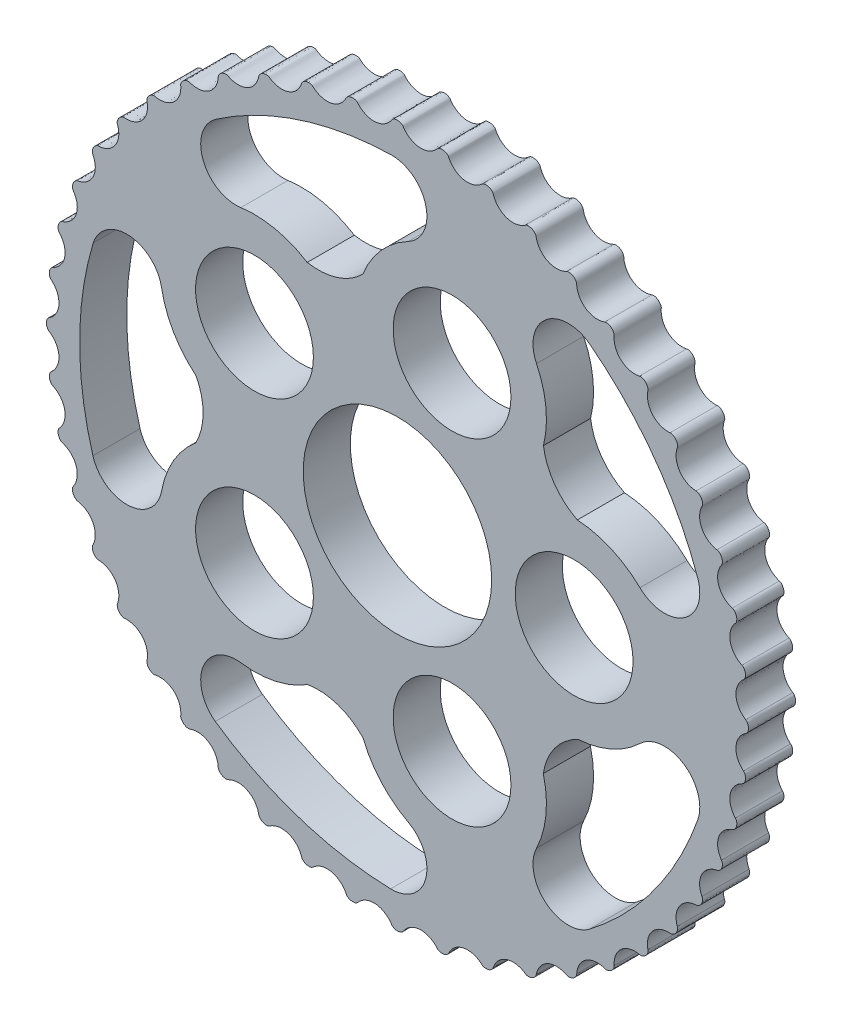
from build123d import *

# Parameters (mm, degrees)
SKETCH_1_R      = 7.999999987
SKETCH_1_R_2    = 5.000000092
EXTRUDE_1_DEPTH = 4


with BuildPart() as part:
    # 草图1 → 凸台-拉伸1 (new body)
    with BuildSketch(Plane.XY):
        with BuildLine():
            add(Edge.make_bspline(
                [(-23.756839752, 17.589365005), (-23.763816236, 17.620618264), (-23.787312136, 17.672369962), (-23.794612662, 17.752678085), (-23.783060954, 17.832767754), (-23.757608715, 17.926005606), (-23.71245772, 18.034169469), (-23.63979738, 18.153437438), (-23.536000753, 18.25759788), (-23.421446293, 18.33507133), (-23.327577909, 18.377245367), (-23.257706306, 18.399418334), (-23.188516209, 18.39633596), (-23.121984058, 18.395565423), (-23.037509241, 18.38632383), (-22.935847493, 18.386592603), (-22.782051162, 18.396327908), (-22.542591309, 18.440805009), (-22.228492548, 18.546094048), (-21.936202967, 18.718382637), (-21.733738096, 18.894659416), (-21.621993871, 19.022854745), (-21.537650729, 19.13374964), (-21.428664022, 19.302020109), (-21.325665583, 19.519010858), (-21.256733415, 19.761891962), (-21.228005331, 19.948605043), (-21.218444018, 20.101254916), (-21.22090932, 20.233384032), (-21.230567203, 20.375914819), (-21.244979436, 20.478014636), (-21.257722855, 20.539775848)],
                knots=[0, 0, 0, 0, 0.021406688, 0.037438778, 0.053080501, 0.075243885, 0.101831489, 0.131128233, 0.167942493, 0.199083228, 0.22289379, 0.2367033, 0.247360435, 0.268788888, 0.281242099, 0.304030641, 0.336575953, 0.384053579, 0.466276873, 0.556570973, 0.608579292, 0.644912928, 0.669952979, 0.701577431, 0.778695241, 0.829212237, 0.869702514, 0.904632057, 0.931223553, 0.957905827, 1, 1, 1, 1], degree=3))
            add(Edge.make_bspline(
                [(-21.257722855, 20.539775848), (-21.260561404, 20.571672056), (-21.2771012, 20.626047766), (-21.273856984, 20.706621649), (-21.251950297, 20.78451834), (-21.214545826, 20.873636344), (-21.155662887, 20.974981464), (-21.068056572, 21.083745001), (-20.951552274, 21.173466158), (-20.827865528, 21.235324454), (-20.729295385, 21.264885403), (-20.657127391, 21.277748603), (-20.588931555, 21.26566148), (-20.52306917, 21.256213346), (-20.440523317, 21.23602464), (-20.339696218, 21.223021593), (-20.185944923, 21.212599161), (-19.942728256, 21.225439973), (-19.617573676, 21.288830134), (-19.3052965, 21.421493324), (-19.081555007, 21.569835062), (-18.954033921, 21.682348114), (-18.855937658, 21.781285299), (-18.725919644, 21.93389057), (-18.595479395, 22.135580939), (-18.495434605, 22.367386708), (-18.442581347, 22.548752665), (-18.413177025, 22.698848596), (-18.398374926, 22.830169116), (-18.389346184, 22.972741139), (-18.390308417, 23.075848652), (-18.394881358, 23.138744838)],
                knots=[0, 0, 0, 0, 0.021406625, 0.037438715, 0.053080439, 0.075243825, 0.101831431, 0.131128177, 0.167942439, 0.199083176, 0.22289374, 0.236703251, 0.247360387, 0.268788841, 0.281242052, 0.304030595, 0.33657591, 0.384053539, 0.466276839, 0.556570945, 0.608579267, 0.644912905, 0.669952958, 0.701577412, 0.778695227, 0.829212226, 0.869702505, 0.904632051, 0.931223549, 0.957905825, 1, 1, 1, 1], degree=3))
            add(Edge.make_bspline(
                [(-18.394881358, 23.138744838), (-18.393532333, 23.170738674), (-18.402833174, 23.226808069), (-18.389099711, 23.306269176), (-18.35721288, 23.380640054), (-18.308496176, 23.464113378), (-18.236888796, 23.55690571), (-18.135835475, 23.653303841), (-18.008616926, 23.727050559), (-17.87791421, 23.772235289), (-17.776328869, 23.788677355), (-17.703099298, 23.792010695), (-17.637064573, 23.771125636), (-17.572998879, 23.753161565), (-17.493794373, 23.722371181), (-17.395527101, 23.6963188), (-17.244451571, 23.665916962), (-17.001639594, 23.646901773), (-16.670992679, 23.667308433), (-16.344071057, 23.758076321), (-16.102881221, 23.87594485), (-15.961765195, 23.970850495), (-15.851594265, 24.056137127), (-15.702769589, 24.190466082), (-15.547119398, 24.373405094), (-15.417673782, 24.590169267), (-15.341599682, 24.763084878), (-15.292855468, 24.908058683), (-15.261039235, 25.036323677), (-15.233478352, 25.176497488), (-15.220974122, 25.278848499), (-15.217298342, 25.341803488)],
                knots=[0, 0, 0, 0, 0.021406625, 0.037438715, 0.053080439, 0.075243825, 0.101831431, 0.131128177, 0.167942439, 0.199083176, 0.22289374, 0.236703251, 0.247360387, 0.268788841, 0.281242052, 0.304030595, 0.33657591, 0.384053539, 0.466276839, 0.556570945, 0.608579267, 0.644912905, 0.669952958, 0.701577412, 0.778695227, 0.829212226, 0.869702505, 0.904632051, 0.931223549, 0.957905825, 1, 1, 1, 1], degree=3))
            add(Edge.make_bspline(
                [(-15.217298342, 25.341803488), (-15.211784824, 25.37334753), (-15.213687571, 25.430151246), (-15.189699844, 25.507139976), (-15.148378461, 25.576712534), (-15.08918308, 25.653112927), (-15.006076481, 25.735764769), (-14.893305204, 25.818148095), (-14.75754915, 25.874658547), (-14.622066823, 25.902396588), (-14.519204439, 25.905438441), (-14.446166268, 25.899184887), (-14.383422527, 25.869859241), (-14.322249706, 25.843686605), (-14.247741756, 25.802821374), (-14.153715693, 25.764165422), (-14.007900871, 25.714304362), (-13.769648164, 25.663758528), (-13.439166376, 25.640832524), (-13.103194027, 25.688152045), (-12.848682673, 25.773530601), (-12.696386242, 25.849204978), (-12.5760257, 25.919381779), (-12.410940792, 26.033136013), (-12.232743878, 26.194193529), (-12.076112285, 26.392207211), (-11.978118993, 26.553713843), (-11.910868914, 26.691084981), (-11.862582932, 26.814099798), (-11.816961482, 26.949476986), (-11.79120474, 27.04932024), (-11.779343132, 27.111256855)],
                knots=[0, 0, 0, 0, 0.021406625, 0.037438715, 0.053080439, 0.075243825, 0.101831431, 0.131128177, 0.167942439, 0.199083176, 0.22289374, 0.236703251, 0.247360387, 0.268788841, 0.281242052, 0.304030595, 0.33657591, 0.384053539, 0.466276839, 0.556570945, 0.608579267, 0.644912905, 0.669952958, 0.701577412, 0.778695227, 0.829212226, 0.869702505, 0.904632051, 0.931223549, 0.957905825, 1, 1, 1, 1], degree=3))
            add(Edge.make_bspline(
                [(-11.779343132, 27.111256855), (-11.769759459, 27.141811374), (-11.764231555, 27.198377485), (-11.7304, 27.271576539), (-11.680351087, 27.335160372), (-11.611689878, 27.4031806), (-11.518506037, 27.474277757), (-11.395946352, 27.541236677), (-11.253975616, 27.579543953), (-11.116031818, 27.589360699), (-11.013652394, 27.578950294), (-10.942055328, 27.563216845), (-10.883676133, 27.525952383), (-10.826442868, 27.492019002), (-10.757906328, 27.441778139), (-10.669730285, 27.39118003), (-10.531671103, 27.322712885), (-10.302054236, 27.241501259), (-9.97739221, 27.175634861), (-9.638117714, 27.178696365), (-9.374639602, 27.230124098), (-9.2137686, 27.285272397), (-9.085277849, 27.339138623), (-8.906757358, 27.430371769), (-8.709062719, 27.566792051), (-8.527925158, 27.742667173), (-8.409689367, 27.890001403), (-8.32508409, 28.017419414), (-8.261154546, 28.133079237), (-8.198253125, 28.26134346), (-8.159684576, 28.356970612), (-8.139840095, 28.4168291)],
                knots=[0, 0, 0, 0, 0.021406625, 0.037438715, 0.053080439, 0.075243825, 0.101831431, 0.131128177, 0.167942439, 0.199083176, 0.22289374, 0.236703251, 0.247360387, 0.268788841, 0.281242052, 0.304030595, 0.33657591, 0.384053539, 0.466276839, 0.556570945, 0.608579267, 0.644912905, 0.669952958, 0.701577412, 0.778695227, 0.829212226, 0.869702505, 0.904632051, 0.931223549, 0.957905825, 1, 1, 1, 1], degree=3))
            add(Edge.make_bspline(
                [(-8.139840095, 28.4168291), (-8.126350246, 28.445871301), (-8.113486275, 28.501231945), (-8.070389761, 28.569388866), (-8.012469667, 28.625896036), (-7.935517443, 28.684372257), (-7.833850762, 28.742698235), (-7.703599699, 28.793087063), (-7.557843439, 28.812535716), (-7.419798427, 28.804263199), (-7.319653704, 28.78057866), (-7.250722788, 28.755634521), (-7.197707023, 28.711068847), (-7.145392592, 28.669955331), (-7.08400014, 28.611198472), (-7.003182833, 28.549523954), (-6.875241523, 28.463622216), (-6.658189305, 28.353134351), (-6.344902097, 28.245454551), (-6.008130535, 28.204205655), (-5.740193849, 28.220802623), (-5.573500823, 28.254481241), (-5.439078374, 28.291115225), (-5.250176836, 28.358266259), (-5.036367082, 28.467715118), (-4.833822868, 28.618442408), (-4.697367625, 28.749083305), (-4.59685477, 28.864368033), (-4.518375516, 28.97069389), (-4.439270385, 29.089650513), (-4.388549946, 29.179425355), (-4.361062137, 29.236181521)],
                knots=[0, 0, 0, 0, 0.021406625, 0.037438715, 0.053080439, 0.075243825, 0.101831431, 0.131128177, 0.167942439, 0.199083176, 0.22289374, 0.236703251, 0.247360387, 0.268788841, 0.281242052, 0.304030595, 0.33657591, 0.384053539, 0.466276839, 0.556570945, 0.608579267, 0.644912905, 0.669952958, 0.701577412, 0.778695227, 0.829212226, 0.869702505, 0.904632051, 0.931223549, 0.957905825, 1, 1, 1, 1], degree=3))
            add(Edge.make_bspline(
                [(-4.361062137, 29.236181521), (-4.343896928, 29.263214483), (-4.323916996, 29.316422424), (-4.272292915, 29.378371029), (-4.20749267, 29.426834684), (-4.123566104, 29.474766351), (-4.015156128, 29.519323177), (-3.879442319, 29.552279747), (-3.732394465, 29.552537004), (-3.596610228, 29.52631677), (-3.50041371, 29.489763346), (-3.43532837, 29.456035318), (-3.38858315, 29.404930964), (-3.342082668, 29.357340776), (-3.288884745, 29.291073267), (-3.216808982, 29.219377607), (-3.101174654, 29.117511078), (-2.900400908, 28.979637453), (-2.60384895, 28.831986682), (-2.275342576, 28.747133167), (-2.007531787, 28.72861539), (-1.837868901, 28.740248076), (-1.699814761, 28.759023001), (-1.503764332, 28.800942951), (-1.277497807, 28.881547687), (-1.057012529, 29.004548159), (-0.90467262, 29.116260422), (-0.78997199, 29.217439313), (-0.698285828, 29.312611939), (-0.604330497, 29.420225579), (-0.542326011, 29.50261204), (-0.507665197, 29.55529477)],
                knots=[0, 0, 0, 0, 0.021406625, 0.037438715, 0.053080439, 0.075243825, 0.101831431, 0.131128177, 0.167942439, 0.199083176, 0.22289374, 0.236703251, 0.247360387, 0.268788841, 0.281242052, 0.304030595, 0.33657591, 0.384053539, 0.466276839, 0.556570945, 0.608579267, 0.644912905, 0.669952958, 0.701577412, 0.778695227, 0.829212226, 0.869702505, 0.904632051, 0.931223549, 0.957905825, 1, 1, 1, 1], degree=3))
            add(Edge.make_bspline(
                [(-0.507665197, 29.55529477), (-0.487118329, 29.579855952), (-0.460364298, 29.630000787), (-0.401095952, 29.684681119), (-0.330524306, 29.72427203), (-0.241059406, 29.760839021), (-0.127761059, 29.790864316), (0.011093395, 29.805824731), (0.156916812, 29.78688619), (0.288116969, 29.743166875), (0.378719334, 29.694370005), (0.438845468, 29.652435184), (0.478520319, 29.595666559), (0.518411218, 29.54241398), (0.56250438, 29.469769677), (0.624605363, 29.389279609), (0.725954173, 29.273191254), (0.907014153, 29.110290924), (1.181756774, 28.925195528), (1.496377125, 28.79818926), (1.759479701, 28.744873582), (1.929209467, 28.734261299), (2.068533154, 28.734855921), (2.268377996, 28.750827524), (2.503229808, 28.801208967), (2.737883588, 28.894378049), (2.903501584, 28.98525025), (3.03042743, 29.070592105), (3.133751725, 29.15298307), (3.240949654, 29.24741243), (3.313177274, 29.321000853), (3.354418036, 29.368708731)],
                knots=[0, 0, 0, 0, 0.021406625, 0.037438715, 0.053080439, 0.075243825, 0.101831431, 0.131128177, 0.167942439, 0.199083176, 0.22289374, 0.236703251, 0.247360387, 0.268788841, 0.281242052, 0.304030595, 0.33657591, 0.384053539, 0.466276839, 0.556570945, 0.608579267, 0.644912905, 0.669952958, 0.701577412, 0.778695227, 0.829212226, 0.869702505, 0.904632051, 0.931223549, 0.957905825, 1, 1, 1, 1], degree=3))
            add(Edge.make_bspline(
                [(3.354418036, 29.368708731), (3.377994999, 29.390377884), (3.41106536, 29.436601622), (3.476963873, 29.483078084), (3.552099419, 29.513118842), (3.645571885, 29.537695484), (3.761820036, 29.552675506), (3.901439297, 29.54938379), (4.0435432, 29.511573496), (4.167914406, 29.451103148), (4.251372385, 29.390897761), (4.305510539, 29.341473662), (4.337436174, 29.280012093), (4.370034944, 29.222008291), (4.404268898, 29.144230157), (4.455332537, 29.056322888), (4.540661723, 28.92799901), (4.69890995, 28.742859246), (4.947142313, 28.523486258), (5.242493398, 28.356500351), (5.496386002, 28.269299018), (5.663278526, 28.236623345), (5.801487894, 28.219027489), (6.001707747, 28.208777467), (6.241126468, 28.228073577), (6.485933758, 28.28981712), (6.661996071, 28.35829441), (6.798975396, 28.426339006), (6.912169917, 28.494538579), (7.030776257, 28.574167944), (7.111991176, 28.637699212), (7.159106245, 28.679615943)],
                knots=[0, 0, 0, 0, 0.021406625, 0.037438715, 0.053080439, 0.075243825, 0.101831431, 0.131128177, 0.167942439, 0.199083176, 0.22289374, 0.236703251, 0.247360387, 0.268788841, 0.281242052, 0.304030595, 0.33657591, 0.384053539, 0.466276839, 0.556570945, 0.608579267, 0.644912905, 0.669952958, 0.701577412, 0.778695227, 0.829212226, 0.869702505, 0.904632051, 0.931223549, 0.957905825, 1, 1, 1, 1], degree=3))
            add(Edge.make_bspline(
                [(7.159106245, 28.679615943), (7.185309897, 28.698022302), (7.224130745, 28.739534041), (7.295531882, 28.777011409), (7.373945739, 28.796988007), (7.46982643, 28.809153787), (7.587035348, 28.808832226), (7.725030492, 28.7873447), (7.860983442, 28.731309597), (7.976397671, 28.655122881), (8.051283275, 28.584539107), (8.098507131, 28.528471391), (8.122137293, 28.463368503), (8.146886161, 28.401605938), (8.170675155, 28.320024779), (8.209827736, 28.226204427), (8.277677292, 28.087840684), (8.410406095, 27.883629277), (8.627880875, 27.633732231), (8.898909156, 27.429623858), (9.139247616, 27.310028911), (9.30044732, 27.255848936), (9.435177567, 27.220363673), (9.632346615, 27.184067406), (9.872235724, 27.171948021), (10.123007803, 27.201209576), (10.306501958, 27.24612029), (10.451191008, 27.295703366), (10.572318964, 27.348544632), (10.700304329, 27.412011523), (10.789116938, 27.464398598), (10.841300162, 27.499806975)],
                knots=[0, 0, 0, 0, 0.021406625, 0.037438715, 0.053080439, 0.075243825, 0.101831431, 0.131128177, 0.167942439, 0.199083176, 0.22289374, 0.236703251, 0.247360387, 0.268788841, 0.281242052, 0.304030595, 0.33657591, 0.384053539, 0.466276839, 0.556570945, 0.608579267, 0.644912905, 0.669952958, 0.701577412, 0.778695227, 0.829212226, 0.869702505, 0.904632051, 0.931223549, 0.957905825, 1, 1, 1, 1], degree=3))
            add(Edge.make_bspline(
                [(10.841300162, 27.499806975), (10.86968215, 27.514635603), (10.913589249, 27.550725065), (10.989271318, 27.578562091), (11.069621803, 27.588132724), (11.166270175, 27.587679483), (11.282434382, 27.572061838), (11.416444273, 27.53274616), (11.543920078, 27.459445024), (11.64840256, 27.368845517), (11.713434477, 27.289091064), (11.75293602, 27.227339065), (11.767866391, 27.159708786), (11.784341896, 27.095244233), (11.797278894, 27.011255926), (11.823850506, 26.913127782), (11.873059508, 26.767091616), (11.977997859, 26.547302681), (12.160994003, 26.271157383), (12.40306211, 26.033418897), (12.625734169, 25.883476636), (12.778482881, 25.808719396), (12.907428736, 25.755951888), (13.098173362, 25.694230415), (13.334428289, 25.650902901), (13.586874377, 25.647181795), (13.77466074, 25.667757499), (13.924583845, 25.698030673), (14.051572704, 25.734609504), (14.186747227, 25.780827985), (14.281637918, 25.82117451), (14.337996428, 25.849468685)],
                knots=[0, 0, 0, 0, 0.021406625, 0.037438715, 0.053080439, 0.075243825, 0.101831431, 0.131128177, 0.167942439, 0.199083176, 0.22289374, 0.236703251, 0.247360387, 0.268788841, 0.281242052, 0.304030595, 0.33657591, 0.384053539, 0.466276839, 0.556570945, 0.608579267, 0.644912905, 0.669952958, 0.701577412, 0.778695227, 0.829212226, 0.869702505, 0.904632051, 0.931223549, 0.957905825, 1, 1, 1, 1], degree=3))
            add(Edge.make_bspline(
                [(14.337996428, 25.849468685), (14.368071128, 25.860465859), (14.416313216, 25.890515545), (14.494981275, 25.908235928), (14.575893569, 25.907236841), (14.671655941, 25.894172333), (14.784787835, 25.863525828), (14.912519527, 25.807054701), (15.029337041, 25.717741734), (15.121100052, 25.614279618), (15.175165567, 25.526719107), (15.206268916, 25.460339419), (15.212244032, 25.391338922), (15.220164275, 25.325275387), (15.222027921, 25.240316994), (15.235563916, 25.139560059), (15.265290383, 24.988350189), (15.34064276, 24.756744375), (15.486029152, 24.459075749), (15.694995234, 24.19177492), (15.896190909, 24.014050901), (16.037875058, 23.919995511), (16.158830221, 23.850848625), (16.339886732, 23.764758018), (16.568465089, 23.690963721), (16.818265765, 23.654323623), (17.007131257, 23.650212259), (17.159723191, 23.660657551), (17.290400138, 23.680348073), (17.430450947, 23.708527332), (17.529796113, 23.736142966), (17.589365599, 23.756838819)],
                knots=[0, 0, 0, 0, 0.021406625, 0.037438715, 0.053080439, 0.075243825, 0.101831431, 0.131128177, 0.167942439, 0.199083176, 0.22289374, 0.236703251, 0.247360387, 0.268788841, 0.281242052, 0.304030595, 0.33657591, 0.384053539, 0.466276839, 0.556570945, 0.608579267, 0.644912905, 0.669952958, 0.701577412, 0.778695227, 0.829212226, 0.869702505, 0.904632051, 0.931223549, 0.957905825, 1, 1, 1, 1], degree=3))
            add(Edge.make_bspline(
                [(17.589365599, 23.756838819), (17.620618425, 23.763816375), (17.672370067, 23.787312125), (17.752678084, 23.794612666), (17.832767755, 23.783060952), (17.926005605, 23.757608716), (18.034169469, 23.71245772), (18.153437438, 23.63979738), (18.25759788, 23.536000753), (18.33507133, 23.421446293), (18.377245367, 23.327577909), (18.399418334, 23.257706306), (18.39633596, 23.188516209), (18.395565423, 23.121984058), (18.38632383, 23.037509241), (18.386592603, 22.935847493), (18.396327908, 22.782051162), (18.440805009, 22.542591309), (18.546094048, 22.228492548), (18.718382637, 21.936202967), (18.894659416, 21.733738096), (19.022854745, 21.621993871), (19.13374964, 21.537650729), (19.302020109, 21.428664022), (19.519010858, 21.325665583), (19.761891962, 21.256733415), (19.948605043, 21.228005331), (20.101254916, 21.218444018), (20.233384032, 21.22090932), (20.375914819, 21.230567203), (20.478014636, 21.244979436), (20.539775848, 21.257722855)],
                knots=[0, 0, 0, 0, 0.021406625, 0.037438715, 0.053080439, 0.075243825, 0.101831431, 0.131128177, 0.167942439, 0.199083176, 0.22289374, 0.236703251, 0.247360387, 0.268788841, 0.281242052, 0.304030595, 0.33657591, 0.384053539, 0.466276839, 0.556570945, 0.608579267, 0.644912905, 0.669952958, 0.701577412, 0.778695227, 0.829212226, 0.869702505, 0.904632051, 0.931223549, 0.957905825, 1, 1, 1, 1], degree=3))
            add(Edge.make_bspline(
                [(20.539775848, 21.257722855), (20.571672056, 21.260561404), (20.626047766, 21.2771012), (20.706621649, 21.273856984), (20.78451834, 21.251950297), (20.873636344, 21.214545826), (20.974981464, 21.155662887), (21.083745001, 21.068056572), (21.173466158, 20.951552274), (21.235324454, 20.827865528), (21.264885403, 20.729295385), (21.277748603, 20.657127391), (21.26566148, 20.588931555), (21.256213346, 20.52306917), (21.23602464, 20.440523317), (21.223021593, 20.339696218), (21.212599161, 20.185944923), (21.225439973, 19.942728256), (21.288830134, 19.617573676), (21.421493324, 19.3052965), (21.569835062, 19.081555007), (21.682348114, 18.954033921), (21.781285299, 18.855937658), (21.93389057, 18.725919644), (22.135580939, 18.595479395), (22.367386708, 18.495434605), (22.548752665, 18.442581347), (22.698848596, 18.413177025), (22.830169116, 18.398374926), (22.972741139, 18.389346184), (23.075848652, 18.390308417), (23.138744838, 18.394881358)],
                knots=[0, 0, 0, 0, 0.021406625, 0.037438715, 0.053080439, 0.075243825, 0.101831431, 0.131128177, 0.167942439, 0.199083176, 0.22289374, 0.236703251, 0.247360387, 0.268788841, 0.281242052, 0.304030595, 0.33657591, 0.384053539, 0.466276839, 0.556570945, 0.608579267, 0.644912905, 0.669952958, 0.701577412, 0.778695227, 0.829212226, 0.869702505, 0.904632051, 0.931223549, 0.957905825, 1, 1, 1, 1], degree=3))
            add(Edge.make_bspline(
                [(23.138744838, 18.394881358), (23.170738674, 18.393532333), (23.226808069, 18.402833174), (23.306269176, 18.389099711), (23.380640054, 18.35721288), (23.464113378, 18.308496176), (23.55690571, 18.236888796), (23.653303841, 18.135835475), (23.727050559, 18.008616926), (23.772235289, 17.87791421), (23.788677355, 17.776328869), (23.792010695, 17.703099298), (23.771125636, 17.637064573), (23.753161565, 17.572998879), (23.722371181, 17.493794373), (23.6963188, 17.395527101), (23.665916962, 17.244451571), (23.646901773, 17.001639594), (23.667308433, 16.670992679), (23.758076321, 16.344071057), (23.87594485, 16.102881221), (23.970850495, 15.961765195), (24.056137127, 15.851594265), (24.190466082, 15.702769589), (24.373405094, 15.547119398), (24.590169267, 15.417673782), (24.763084878, 15.341599682), (24.908058683, 15.292855468), (25.036323677, 15.261039235), (25.176497488, 15.233478352), (25.278848499, 15.220974122), (25.341803488, 15.217298342)],
                knots=[0, 0, 0, 0, 0.021406625, 0.037438715, 0.053080439, 0.075243825, 0.101831431, 0.131128177, 0.167942439, 0.199083176, 0.22289374, 0.236703251, 0.247360387, 0.268788841, 0.281242052, 0.304030595, 0.33657591, 0.384053539, 0.466276839, 0.556570945, 0.608579267, 0.644912905, 0.669952958, 0.701577412, 0.778695227, 0.829212226, 0.869702505, 0.904632051, 0.931223549, 0.957905825, 1, 1, 1, 1], degree=3))
            add(Edge.make_bspline(
                [(25.341803488, 15.217298342), (25.37334753, 15.211784824), (25.430151246, 15.213687571), (25.507139976, 15.189699844), (25.576712534, 15.148378461), (25.653112927, 15.08918308), (25.735764769, 15.006076481), (25.818148095, 14.893305204), (25.874658547, 14.75754915), (25.902396588, 14.622066823), (25.905438441, 14.519204439), (25.899184887, 14.446166268), (25.869859241, 14.383422527), (25.843686605, 14.322249706), (25.802821374, 14.247741756), (25.764165422, 14.153715693), (25.714304362, 14.007900871), (25.663758528, 13.769648164), (25.640832524, 13.439166376), (25.688152045, 13.103194027), (25.773530601, 12.848682673), (25.849204978, 12.696386242), (25.919381779, 12.5760257), (26.033136013, 12.410940792), (26.194193529, 12.232743878), (26.392207211, 12.076112285), (26.553713843, 11.978118993), (26.691084981, 11.910868914), (26.814099798, 11.862582932), (26.949476986, 11.816961482), (27.04932024, 11.79120474), (27.111256855, 11.779343132)],
                knots=[0, 0, 0, 0, 0.021406625, 0.037438715, 0.053080439, 0.075243825, 0.101831431, 0.131128177, 0.167942439, 0.199083176, 0.22289374, 0.236703251, 0.247360387, 0.268788841, 0.281242052, 0.304030595, 0.33657591, 0.384053539, 0.466276839, 0.556570945, 0.608579267, 0.644912905, 0.669952958, 0.701577412, 0.778695227, 0.829212226, 0.869702505, 0.904632051, 0.931223549, 0.957905825, 1, 1, 1, 1], degree=3))
            add(Edge.make_bspline(
                [(27.111256855, 11.779343132), (27.141811374, 11.769759459), (27.198377485, 11.764231555), (27.271576539, 11.7304), (27.335160372, 11.680351087), (27.4031806, 11.611689878), (27.474277757, 11.518506037), (27.541236677, 11.395946352), (27.579543953, 11.253975616), (27.589360699, 11.116031818), (27.578950294, 11.013652394), (27.563216845, 10.942055328), (27.525952383, 10.883676133), (27.492019002, 10.826442868), (27.441778139, 10.757906328), (27.39118003, 10.669730285), (27.322712885, 10.531671103), (27.241501259, 10.302054236), (27.175634861, 9.97739221), (27.178696365, 9.638117714), (27.230124098, 9.374639602), (27.285272397, 9.2137686), (27.339138623, 9.085277849), (27.430371769, 8.906757358), (27.566792051, 8.709062719), (27.742667173, 8.527925158), (27.890001403, 8.409689367), (28.017419414, 8.32508409), (28.133079237, 8.261154546), (28.26134346, 8.198253125), (28.356970612, 8.159684576), (28.4168291, 8.139840095)],
                knots=[0, 0, 0, 0, 0.021406625, 0.037438715, 0.053080439, 0.075243825, 0.101831431, 0.131128177, 0.167942439, 0.199083176, 0.22289374, 0.236703251, 0.247360387, 0.268788841, 0.281242052, 0.304030595, 0.33657591, 0.384053539, 0.466276839, 0.556570945, 0.608579267, 0.644912905, 0.669952958, 0.701577412, 0.778695227, 0.829212226, 0.869702505, 0.904632051, 0.931223549, 0.957905825, 1, 1, 1, 1], degree=3))
            add(Edge.make_bspline(
                [(28.4168291, 8.139840095), (28.445871301, 8.126350246), (28.501231945, 8.113486275), (28.569388866, 8.070389761), (28.625896036, 8.012469667), (28.684372257, 7.935517443), (28.742698235, 7.833850762), (28.793087063, 7.703599699), (28.812535716, 7.557843439), (28.804263199, 7.419798427), (28.78057866, 7.319653704), (28.755634521, 7.250722788), (28.711068847, 7.197707023), (28.669955331, 7.145392592), (28.611198472, 7.08400014), (28.549523954, 7.003182833), (28.463622216, 6.875241523), (28.353134351, 6.658189305), (28.245454551, 6.344902097), (28.204205655, 6.008130535), (28.220802623, 5.740193849), (28.254481241, 5.573500823), (28.291115225, 5.439078374), (28.358266259, 5.250176836), (28.467715118, 5.036367082), (28.618442408, 4.833822868), (28.749083305, 4.697367625), (28.864368033, 4.59685477), (28.97069389, 4.518375516), (29.089650513, 4.439270385), (29.179425355, 4.388549946), (29.236181521, 4.361062137)],
                knots=[0, 0, 0, 0, 0.021406625, 0.037438715, 0.053080439, 0.075243825, 0.101831431, 0.131128177, 0.167942439, 0.199083176, 0.22289374, 0.236703251, 0.247360387, 0.268788841, 0.281242052, 0.304030595, 0.33657591, 0.384053539, 0.466276839, 0.556570945, 0.608579267, 0.644912905, 0.669952958, 0.701577412, 0.778695227, 0.829212226, 0.869702505, 0.904632051, 0.931223549, 0.957905825, 1, 1, 1, 1], degree=3))
            add(Edge.make_bspline(
                [(29.236181521, 4.361062137), (29.263214483, 4.343896928), (29.316422424, 4.323916996), (29.378371029, 4.272292915), (29.426834684, 4.20749267), (29.474766351, 4.123566104), (29.519323177, 4.015156128), (29.552279747, 3.879442319), (29.552537004, 3.732394465), (29.52631677, 3.596610228), (29.489763346, 3.50041371), (29.456035318, 3.43532837), (29.404930964, 3.38858315), (29.357340776, 3.342082668), (29.291073267, 3.288884745), (29.219377607, 3.216808982), (29.117511078, 3.101174654), (28.979637453, 2.900400908), (28.831986682, 2.60384895), (28.747133167, 2.275342576), (28.72861539, 2.007531787), (28.740248076, 1.837868901), (28.759023001, 1.699814761), (28.800942951, 1.503764332), (28.881547687, 1.277497807), (29.004548159, 1.057012529), (29.116260422, 0.90467262), (29.217439313, 0.78997199), (29.312611939, 0.698285828), (29.420225579, 0.604330497), (29.50261204, 0.542326011), (29.55529477, 0.507665197)],
                knots=[0, 0, 0, 0, 0.021406625, 0.037438715, 0.053080439, 0.075243825, 0.101831431, 0.131128177, 0.167942439, 0.199083176, 0.22289374, 0.236703251, 0.247360387, 0.268788841, 0.281242052, 0.304030595, 0.33657591, 0.384053539, 0.466276839, 0.556570945, 0.608579267, 0.644912905, 0.669952958, 0.701577412, 0.778695227, 0.829212226, 0.869702505, 0.904632051, 0.931223549, 0.957905825, 1, 1, 1, 1], degree=3))
            add(Edge.make_bspline(
                [(29.55529477, 0.507665197), (29.579855952, 0.487118329), (29.630000787, 0.460364298), (29.684681119, 0.401095952), (29.72427203, 0.330524306), (29.760839021, 0.241059406), (29.790864316, 0.127761059), (29.805824731, -0.011093395), (29.78688619, -0.156916812), (29.743166875, -0.288116969), (29.694370005, -0.378719334), (29.652435184, -0.438845468), (29.595666559, -0.478520319), (29.54241398, -0.518411218), (29.469769677, -0.56250438), (29.389279609, -0.624605363), (29.273191254, -0.725954173), (29.110290924, -0.907014153), (28.925195528, -1.181756774), (28.79818926, -1.496377125), (28.744873582, -1.759479701), (28.734261299, -1.929209467), (28.734855921, -2.068533154), (28.750827524, -2.268377996), (28.801208967, -2.503229808), (28.894378049, -2.737883588), (28.98525025, -2.903501584), (29.070592105, -3.03042743), (29.15298307, -3.133751725), (29.24741243, -3.240949654), (29.321000853, -3.313177274), (29.368708731, -3.354418036)],
                knots=[0, 0, 0, 0, 0.021406625, 0.037438715, 0.053080439, 0.075243825, 0.101831431, 0.131128177, 0.167942439, 0.199083176, 0.22289374, 0.236703251, 0.247360387, 0.268788841, 0.281242052, 0.304030595, 0.33657591, 0.384053539, 0.466276839, 0.556570945, 0.608579267, 0.644912905, 0.669952958, 0.701577412, 0.778695227, 0.829212226, 0.869702505, 0.904632051, 0.931223549, 0.957905825, 1, 1, 1, 1], degree=3))
            add(Edge.make_bspline(
                [(29.368708731, -3.354418036), (29.390377884, -3.377994999), (29.436601622, -3.41106536), (29.483078084, -3.476963873), (29.513118842, -3.552099419), (29.537695484, -3.645571885), (29.552675506, -3.761820036), (29.54938379, -3.901439297), (29.511573496, -4.0435432), (29.451103148, -4.167914406), (29.390897761, -4.251372385), (29.341473662, -4.305510539), (29.280012093, -4.337436174), (29.222008291, -4.370034944), (29.144230157, -4.404268898), (29.056322888, -4.455332537), (28.92799901, -4.540661723), (28.742859246, -4.69890995), (28.523486258, -4.947142313), (28.356500351, -5.242493398), (28.269299018, -5.496386002), (28.236623345, -5.663278526), (28.219027489, -5.801487894), (28.208777467, -6.001707747), (28.228073577, -6.241126468), (28.28981712, -6.485933758), (28.35829441, -6.661996071), (28.426339006, -6.798975396), (28.494538579, -6.912169917), (28.574167944, -7.030776257), (28.637699212, -7.111991176), (28.679615943, -7.159106245)],
                knots=[0, 0, 0, 0, 0.021406625, 0.037438715, 0.053080439, 0.075243825, 0.101831431, 0.131128177, 0.167942439, 0.199083176, 0.22289374, 0.236703251, 0.247360387, 0.268788841, 0.281242052, 0.304030595, 0.33657591, 0.384053539, 0.466276839, 0.556570945, 0.608579267, 0.644912905, 0.669952958, 0.701577412, 0.778695227, 0.829212226, 0.869702505, 0.904632051, 0.931223549, 0.957905825, 1, 1, 1, 1], degree=3))
            add(Edge.make_bspline(
                [(28.679615943, -7.159106245), (28.698022302, -7.185309897), (28.739534041, -7.224130745), (28.777011409, -7.295531882), (28.796988007, -7.373945739), (28.809153787, -7.46982643), (28.808832226, -7.587035348), (28.7873447, -7.725030492), (28.731309597, -7.860983442), (28.655122881, -7.976397671), (28.584539107, -8.051283275), (28.528471391, -8.098507131), (28.463368503, -8.122137293), (28.401605938, -8.146886161), (28.320024779, -8.170675155), (28.226204427, -8.209827736), (28.087840684, -8.277677292), (27.883629277, -8.410406095), (27.633732231, -8.627880875), (27.429623858, -8.898909156), (27.310028911, -9.139247616), (27.255848936, -9.30044732), (27.220363673, -9.435177567), (27.184067406, -9.632346615), (27.171948021, -9.872235724), (27.201209576, -10.123007803), (27.24612029, -10.306501958), (27.295703366, -10.451191008), (27.348544632, -10.572318964), (27.412011523, -10.700304329), (27.464398598, -10.789116938), (27.499806975, -10.841300162)],
                knots=[0, 0, 0, 0, 0.021406625, 0.037438715, 0.053080439, 0.075243825, 0.101831431, 0.131128177, 0.167942439, 0.199083176, 0.22289374, 0.236703251, 0.247360387, 0.268788841, 0.281242052, 0.304030595, 0.33657591, 0.384053539, 0.466276839, 0.556570945, 0.608579267, 0.644912905, 0.669952958, 0.701577412, 0.778695227, 0.829212226, 0.869702505, 0.904632051, 0.931223549, 0.957905825, 1, 1, 1, 1], degree=3))
            add(Edge.make_bspline(
                [(27.499806975, -10.841300162), (27.514635603, -10.86968215), (27.550725065, -10.913589249), (27.578562091, -10.989271318), (27.588132724, -11.069621803), (27.587679483, -11.166270175), (27.572061838, -11.282434382), (27.53274616, -11.416444273), (27.459445024, -11.543920078), (27.368845517, -11.64840256), (27.289091064, -11.713434477), (27.227339065, -11.75293602), (27.159708786, -11.767866391), (27.095244233, -11.784341896), (27.011255926, -11.797278894), (26.913127782, -11.823850506), (26.767091616, -11.873059508), (26.547302681, -11.977997859), (26.271157383, -12.160994003), (26.033418897, -12.40306211), (25.883476636, -12.625734169), (25.808719396, -12.778482881), (25.755951888, -12.907428736), (25.694230415, -13.098173362), (25.650902901, -13.334428289), (25.647181795, -13.586874377), (25.667757499, -13.77466074), (25.698030673, -13.924583845), (25.734609504, -14.051572704), (25.780827985, -14.186747227), (25.82117451, -14.281637918), (25.849468685, -14.337996428)],
                knots=[0, 0, 0, 0, 0.021406625, 0.037438715, 0.053080439, 0.075243825, 0.101831431, 0.131128177, 0.167942439, 0.199083176, 0.22289374, 0.236703251, 0.247360387, 0.268788841, 0.281242052, 0.304030595, 0.33657591, 0.384053539, 0.466276839, 0.556570945, 0.608579267, 0.644912905, 0.669952958, 0.701577412, 0.778695227, 0.829212226, 0.869702505, 0.904632051, 0.931223549, 0.957905825, 1, 1, 1, 1], degree=3))
            add(Edge.make_bspline(
                [(25.849468685, -14.337996428), (25.860465859, -14.368071128), (25.890515545, -14.416313216), (25.908235928, -14.494981275), (25.907236841, -14.575893569), (25.894172333, -14.671655941), (25.863525828, -14.784787835), (25.807054701, -14.912519527), (25.717741734, -15.029337041), (25.614279618, -15.121100052), (25.526719107, -15.175165567), (25.460339419, -15.206268916), (25.391338922, -15.212244032), (25.325275387, -15.220164275), (25.240316994, -15.222027921), (25.139560059, -15.235563916), (24.988350189, -15.265290383), (24.756744375, -15.34064276), (24.459075749, -15.486029152), (24.19177492, -15.694995234), (24.014050901, -15.896190909), (23.919995511, -16.037875058), (23.850848625, -16.158830221), (23.764758018, -16.339886732), (23.690963721, -16.568465089), (23.654323623, -16.818265765), (23.650212259, -17.007131257), (23.660657551, -17.159723191), (23.680348073, -17.290400138), (23.708527332, -17.430450947), (23.736142966, -17.529796113), (23.756838819, -17.589365599)],
                knots=[0, 0, 0, 0, 0.021406625, 0.037438715, 0.053080439, 0.075243825, 0.101831431, 0.131128177, 0.167942439, 0.199083176, 0.22289374, 0.236703251, 0.247360387, 0.268788841, 0.281242052, 0.304030595, 0.33657591, 0.384053539, 0.466276839, 0.556570945, 0.608579267, 0.644912905, 0.669952958, 0.701577412, 0.778695227, 0.829212226, 0.869702505, 0.904632051, 0.931223549, 0.957905825, 1, 1, 1, 1], degree=3))
            add(Edge.make_bspline(
                [(23.756838819, -17.589365599), (23.763816375, -17.620618425), (23.787312125, -17.672370067), (23.794612666, -17.752678084), (23.783060952, -17.832767755), (23.757608716, -17.926005605), (23.71245772, -18.034169469), (23.63979738, -18.153437438), (23.536000753, -18.25759788), (23.421446293, -18.33507133), (23.327577909, -18.377245367), (23.257706306, -18.399418334), (23.188516209, -18.39633596), (23.121984058, -18.395565423), (23.037509241, -18.38632383), (22.935847493, -18.386592603), (22.782051162, -18.396327908), (22.542591309, -18.440805009), (22.228492548, -18.546094048), (21.936202967, -18.718382637), (21.733738096, -18.894659416), (21.621993871, -19.022854745), (21.537650729, -19.13374964), (21.428664022, -19.302020109), (21.325665583, -19.519010858), (21.256733415, -19.761891962), (21.228005331, -19.948605043), (21.218444018, -20.101254916), (21.22090932, -20.233384032), (21.230567203, -20.375914819), (21.244979436, -20.478014636), (21.257722855, -20.539775848)],
                knots=[0, 0, 0, 0, 0.021406625, 0.037438715, 0.053080439, 0.075243825, 0.101831431, 0.131128177, 0.167942439, 0.199083176, 0.22289374, 0.236703251, 0.247360387, 0.268788841, 0.281242052, 0.304030595, 0.33657591, 0.384053539, 0.466276839, 0.556570945, 0.608579267, 0.644912905, 0.669952958, 0.701577412, 0.778695227, 0.829212226, 0.869702505, 0.904632051, 0.931223549, 0.957905825, 1, 1, 1, 1], degree=3))
            add(Edge.make_bspline(
                [(21.257722855, -20.539775848), (21.260561404, -20.571672056), (21.2771012, -20.626047766), (21.273856984, -20.706621649), (21.251950297, -20.78451834), (21.214545826, -20.873636344), (21.155662887, -20.974981464), (21.068056572, -21.083745001), (20.951552274, -21.173466158), (20.827865528, -21.235324454), (20.729295385, -21.264885403), (20.657127391, -21.277748603), (20.588931555, -21.26566148), (20.52306917, -21.256213346), (20.440523317, -21.23602464), (20.339696218, -21.223021593), (20.185944923, -21.212599161), (19.942728256, -21.225439973), (19.617573676, -21.288830134), (19.3052965, -21.421493324), (19.081555007, -21.569835062), (18.954033921, -21.682348114), (18.855937658, -21.781285299), (18.725919644, -21.93389057), (18.595479395, -22.135580939), (18.495434605, -22.367386708), (18.442581347, -22.548752665), (18.413177025, -22.698848596), (18.398374926, -22.830169116), (18.389346184, -22.972741139), (18.390308417, -23.075848652), (18.394881358, -23.138744838)],
                knots=[0, 0, 0, 0, 0.021406625, 0.037438715, 0.053080439, 0.075243825, 0.101831431, 0.131128177, 0.167942439, 0.199083176, 0.22289374, 0.236703251, 0.247360387, 0.268788841, 0.281242052, 0.304030595, 0.33657591, 0.384053539, 0.466276839, 0.556570945, 0.608579267, 0.644912905, 0.669952958, 0.701577412, 0.778695227, 0.829212226, 0.869702505, 0.904632051, 0.931223549, 0.957905825, 1, 1, 1, 1], degree=3))
            add(Edge.make_bspline(
                [(18.394881358, -23.138744838), (18.393532333, -23.170738674), (18.402833174, -23.226808069), (18.389099711, -23.306269176), (18.35721288, -23.380640054), (18.308496176, -23.464113378), (18.236888796, -23.55690571), (18.135835475, -23.653303841), (18.008616926, -23.727050559), (17.87791421, -23.772235289), (17.776328869, -23.788677355), (17.703099298, -23.792010695), (17.637064573, -23.771125636), (17.572998879, -23.753161565), (17.493794373, -23.722371181), (17.395527101, -23.6963188), (17.244451571, -23.665916962), (17.001639594, -23.646901773), (16.670992679, -23.667308433), (16.344071057, -23.758076321), (16.102881221, -23.87594485), (15.961765195, -23.970850495), (15.851594265, -24.056137127), (15.702769589, -24.190466082), (15.547119398, -24.373405094), (15.417673782, -24.590169267), (15.341599682, -24.763084878), (15.292855468, -24.908058683), (15.261039235, -25.036323677), (15.233478352, -25.176497488), (15.220974122, -25.278848499), (15.217298342, -25.341803488)],
                knots=[0, 0, 0, 0, 0.021406625, 0.037438715, 0.053080439, 0.075243825, 0.101831431, 0.131128177, 0.167942439, 0.199083176, 0.22289374, 0.236703251, 0.247360387, 0.268788841, 0.281242052, 0.304030595, 0.33657591, 0.384053539, 0.466276839, 0.556570945, 0.608579267, 0.644912905, 0.669952958, 0.701577412, 0.778695227, 0.829212226, 0.869702505, 0.904632051, 0.931223549, 0.957905825, 1, 1, 1, 1], degree=3))
            add(Edge.make_bspline(
                [(15.217298342, -25.341803488), (15.211784824, -25.37334753), (15.213687571, -25.430151246), (15.189699844, -25.507139976), (15.148378461, -25.576712534), (15.08918308, -25.653112927), (15.006076481, -25.735764769), (14.893305204, -25.818148095), (14.75754915, -25.874658547), (14.622066823, -25.902396588), (14.519204439, -25.905438441), (14.446166268, -25.899184887), (14.383422527, -25.869859241), (14.322249706, -25.843686605), (14.247741756, -25.802821374), (14.153715693, -25.764165422), (14.007900871, -25.714304362), (13.769648164, -25.663758528), (13.439166376, -25.640832524), (13.103194027, -25.688152045), (12.848682673, -25.773530601), (12.696386242, -25.849204978), (12.5760257, -25.919381779), (12.410940792, -26.033136013), (12.232743878, -26.194193529), (12.076112285, -26.392207211), (11.978118993, -26.553713843), (11.910868914, -26.691084981), (11.862582932, -26.814099798), (11.816961482, -26.949476986), (11.79120474, -27.04932024), (11.779343132, -27.111256855)],
                knots=[0, 0, 0, 0, 0.021406625, 0.037438715, 0.053080439, 0.075243825, 0.101831431, 0.131128177, 0.167942439, 0.199083176, 0.22289374, 0.236703251, 0.247360387, 0.268788841, 0.281242052, 0.304030595, 0.33657591, 0.384053539, 0.466276839, 0.556570945, 0.608579267, 0.644912905, 0.669952958, 0.701577412, 0.778695227, 0.829212226, 0.869702505, 0.904632051, 0.931223549, 0.957905825, 1, 1, 1, 1], degree=3))
            add(Edge.make_bspline(
                [(11.779343132, -27.111256855), (11.769759459, -27.141811374), (11.764231555, -27.198377485), (11.7304, -27.271576539), (11.680351087, -27.335160372), (11.611689878, -27.4031806), (11.518506037, -27.474277757), (11.395946352, -27.541236677), (11.253975616, -27.579543953), (11.116031818, -27.589360699), (11.013652394, -27.578950294), (10.942055328, -27.563216845), (10.883676133, -27.525952383), (10.826442868, -27.492019002), (10.757906328, -27.441778139), (10.669730285, -27.39118003), (10.531671103, -27.322712885), (10.302054236, -27.241501259), (9.97739221, -27.175634861), (9.638117714, -27.178696365), (9.374639602, -27.230124098), (9.2137686, -27.285272397), (9.085277849, -27.339138623), (8.906757358, -27.430371769), (8.709062719, -27.566792051), (8.527925158, -27.742667173), (8.409689367, -27.890001403), (8.32508409, -28.017419414), (8.261154546, -28.133079237), (8.198253125, -28.26134346), (8.159684576, -28.356970612), (8.139840095, -28.4168291)],
                knots=[0, 0, 0, 0, 0.021406625, 0.037438715, 0.053080439, 0.075243825, 0.101831431, 0.131128177, 0.167942439, 0.199083176, 0.22289374, 0.236703251, 0.247360387, 0.268788841, 0.281242052, 0.304030595, 0.33657591, 0.384053539, 0.466276839, 0.556570945, 0.608579267, 0.644912905, 0.669952958, 0.701577412, 0.778695227, 0.829212226, 0.869702505, 0.904632051, 0.931223549, 0.957905825, 1, 1, 1, 1], degree=3))
            add(Edge.make_bspline(
                [(8.139840095, -28.4168291), (8.126350246, -28.445871301), (8.113486275, -28.501231945), (8.070389761, -28.569388866), (8.012469667, -28.625896036), (7.935517443, -28.684372257), (7.833850762, -28.742698235), (7.703599699, -28.793087063), (7.557843439, -28.812535716), (7.419798427, -28.804263199), (7.319653704, -28.78057866), (7.250722788, -28.755634521), (7.197707023, -28.711068847), (7.145392592, -28.669955331), (7.08400014, -28.611198472), (7.003182833, -28.549523954), (6.875241523, -28.463622216), (6.658189305, -28.353134351), (6.344902097, -28.245454551), (6.008130535, -28.204205655), (5.740193849, -28.220802623), (5.573500823, -28.254481241), (5.439078374, -28.291115225), (5.250176836, -28.358266259), (5.036367082, -28.467715118), (4.833822868, -28.618442408), (4.697367625, -28.749083305), (4.59685477, -28.864368033), (4.518375516, -28.97069389), (4.439270385, -29.089650513), (4.388549946, -29.179425355), (4.361062137, -29.236181521)],
                knots=[0, 0, 0, 0, 0.021406625, 0.037438715, 0.053080439, 0.075243825, 0.101831431, 0.131128177, 0.167942439, 0.199083176, 0.22289374, 0.236703251, 0.247360387, 0.268788841, 0.281242052, 0.304030595, 0.33657591, 0.384053539, 0.466276839, 0.556570945, 0.608579267, 0.644912905, 0.669952958, 0.701577412, 0.778695227, 0.829212226, 0.869702505, 0.904632051, 0.931223549, 0.957905825, 1, 1, 1, 1], degree=3))
            add(Edge.make_bspline(
                [(4.361062137, -29.236181521), (4.343896928, -29.263214483), (4.323916996, -29.316422424), (4.272292915, -29.378371029), (4.20749267, -29.426834684), (4.123566104, -29.474766351), (4.015156128, -29.519323177), (3.879442319, -29.552279747), (3.732394465, -29.552537004), (3.596610228, -29.52631677), (3.50041371, -29.489763346), (3.43532837, -29.456035318), (3.38858315, -29.404930964), (3.342082668, -29.357340776), (3.288884745, -29.291073267), (3.216808982, -29.219377607), (3.101174654, -29.117511078), (2.900400908, -28.979637453), (2.60384895, -28.831986682), (2.275342576, -28.747133167), (2.007531787, -28.72861539), (1.837868901, -28.740248076), (1.699814761, -28.759023001), (1.503764332, -28.800942951), (1.277497807, -28.881547687), (1.057012529, -29.004548159), (0.90467262, -29.116260422), (0.78997199, -29.217439313), (0.698285828, -29.312611939), (0.604330497, -29.420225579), (0.542326011, -29.50261204), (0.507665197, -29.55529477)],
                knots=[0, 0, 0, 0, 0.021406625, 0.037438715, 0.053080439, 0.075243825, 0.101831431, 0.131128177, 0.167942439, 0.199083176, 0.22289374, 0.236703251, 0.247360387, 0.268788841, 0.281242052, 0.304030595, 0.33657591, 0.384053539, 0.466276839, 0.556570945, 0.608579267, 0.644912905, 0.669952958, 0.701577412, 0.778695227, 0.829212226, 0.869702505, 0.904632051, 0.931223549, 0.957905825, 1, 1, 1, 1], degree=3))
            add(Edge.make_bspline(
                [(0.507665197, -29.55529477), (0.487118329, -29.579855952), (0.460364298, -29.630000787), (0.401095952, -29.684681119), (0.330524306, -29.72427203), (0.241059406, -29.760839021), (0.127761059, -29.790864316), (-0.011093395, -29.805824731), (-0.156916812, -29.78688619), (-0.288116969, -29.743166875), (-0.378719334, -29.694370005), (-0.438845468, -29.652435184), (-0.478520319, -29.595666559), (-0.518411218, -29.54241398), (-0.56250438, -29.469769677), (-0.624605363, -29.389279609), (-0.725954173, -29.273191254), (-0.907014153, -29.110290924), (-1.181756774, -28.925195528), (-1.496377125, -28.79818926), (-1.759479701, -28.744873582), (-1.929209467, -28.734261299), (-2.068533154, -28.734855921), (-2.268377996, -28.750827524), (-2.503229808, -28.801208967), (-2.737883588, -28.894378049), (-2.903501584, -28.98525025), (-3.03042743, -29.070592105), (-3.133751725, -29.15298307), (-3.240949654, -29.24741243), (-3.313177274, -29.321000853), (-3.354418036, -29.368708731)],
                knots=[0, 0, 0, 0, 0.021406625, 0.037438715, 0.053080439, 0.075243825, 0.101831431, 0.131128177, 0.167942439, 0.199083176, 0.22289374, 0.236703251, 0.247360387, 0.268788841, 0.281242052, 0.304030595, 0.33657591, 0.384053539, 0.466276839, 0.556570945, 0.608579267, 0.644912905, 0.669952958, 0.701577412, 0.778695227, 0.829212226, 0.869702505, 0.904632051, 0.931223549, 0.957905825, 1, 1, 1, 1], degree=3))
            add(Edge.make_bspline(
                [(-3.354418036, -29.368708731), (-3.377994999, -29.390377884), (-3.41106536, -29.436601622), (-3.476963873, -29.483078084), (-3.552099419, -29.513118842), (-3.645571885, -29.537695484), (-3.761820036, -29.552675506), (-3.901439297, -29.54938379), (-4.0435432, -29.511573496), (-4.167914406, -29.451103148), (-4.251372385, -29.390897761), (-4.305510539, -29.341473662), (-4.337436174, -29.280012093), (-4.370034944, -29.222008291), (-4.404268898, -29.144230157), (-4.455332537, -29.056322888), (-4.540661723, -28.92799901), (-4.69890995, -28.742859246), (-4.947142313, -28.523486258), (-5.242493398, -28.356500351), (-5.496386002, -28.269299018), (-5.663278526, -28.236623345), (-5.801487894, -28.219027489), (-6.001707747, -28.208777467), (-6.241126468, -28.228073577), (-6.485933758, -28.28981712), (-6.661996071, -28.35829441), (-6.798975396, -28.426339006), (-6.912169917, -28.494538579), (-7.030776257, -28.574167944), (-7.111991176, -28.637699212), (-7.159106245, -28.679615943)],
                knots=[0, 0, 0, 0, 0.021406625, 0.037438715, 0.053080439, 0.075243825, 0.101831431, 0.131128177, 0.167942439, 0.199083176, 0.22289374, 0.236703251, 0.247360387, 0.268788841, 0.281242052, 0.304030595, 0.33657591, 0.384053539, 0.466276839, 0.556570945, 0.608579267, 0.644912905, 0.669952958, 0.701577412, 0.778695227, 0.829212226, 0.869702505, 0.904632051, 0.931223549, 0.957905825, 1, 1, 1, 1], degree=3))
            add(Edge.make_bspline(
                [(-7.159106245, -28.679615943), (-7.185309897, -28.698022302), (-7.224130745, -28.739534041), (-7.295531882, -28.777011409), (-7.373945739, -28.796988007), (-7.46982643, -28.809153787), (-7.587035348, -28.808832226), (-7.725030492, -28.7873447), (-7.860983442, -28.731309597), (-7.976397671, -28.655122881), (-8.051283275, -28.584539107), (-8.098507131, -28.528471391), (-8.122137293, -28.463368503), (-8.146886161, -28.401605938), (-8.170675155, -28.320024779), (-8.209827736, -28.226204427), (-8.277677292, -28.087840684), (-8.410406095, -27.883629277), (-8.627880875, -27.633732231), (-8.898909156, -27.429623858), (-9.139247616, -27.310028911), (-9.30044732, -27.255848936), (-9.435177567, -27.220363673), (-9.632346615, -27.184067406), (-9.872235724, -27.171948021), (-10.123007803, -27.201209576), (-10.306501958, -27.24612029), (-10.451191008, -27.295703366), (-10.572318964, -27.348544632), (-10.700304329, -27.412011523), (-10.789116938, -27.464398598), (-10.841300162, -27.499806975)],
                knots=[0, 0, 0, 0, 0.021406625, 0.037438715, 0.053080439, 0.075243825, 0.101831431, 0.131128177, 0.167942439, 0.199083176, 0.22289374, 0.236703251, 0.247360387, 0.268788841, 0.281242052, 0.304030595, 0.33657591, 0.384053539, 0.466276839, 0.556570945, 0.608579267, 0.644912905, 0.669952958, 0.701577412, 0.778695227, 0.829212226, 0.869702505, 0.904632051, 0.931223549, 0.957905825, 1, 1, 1, 1], degree=3))
            add(Edge.make_bspline(
                [(-10.841300162, -27.499806975), (-10.86968215, -27.514635603), (-10.913589249, -27.550725065), (-10.989271318, -27.578562091), (-11.069621803, -27.588132724), (-11.166270175, -27.587679483), (-11.282434382, -27.572061838), (-11.416444273, -27.53274616), (-11.543920078, -27.459445024), (-11.64840256, -27.368845517), (-11.713434477, -27.289091064), (-11.75293602, -27.227339065), (-11.767866391, -27.159708786), (-11.784341896, -27.095244233), (-11.797278894, -27.011255926), (-11.823850506, -26.913127782), (-11.873059508, -26.767091616), (-11.977997859, -26.547302681), (-12.160994003, -26.271157383), (-12.40306211, -26.033418897), (-12.625734169, -25.883476636), (-12.778482881, -25.808719396), (-12.907428736, -25.755951888), (-13.098173362, -25.694230415), (-13.334428289, -25.650902901), (-13.586874377, -25.647181795), (-13.77466074, -25.667757499), (-13.924583845, -25.698030673), (-14.051572704, -25.734609504), (-14.186747227, -25.780827985), (-14.281637918, -25.82117451), (-14.337996428, -25.849468685)],
                knots=[0, 0, 0, 0, 0.021406625, 0.037438715, 0.053080439, 0.075243825, 0.101831431, 0.131128177, 0.167942439, 0.199083176, 0.22289374, 0.236703251, 0.247360387, 0.268788841, 0.281242052, 0.304030595, 0.33657591, 0.384053539, 0.466276839, 0.556570945, 0.608579267, 0.644912905, 0.669952958, 0.701577412, 0.778695227, 0.829212226, 0.869702505, 0.904632051, 0.931223549, 0.957905825, 1, 1, 1, 1], degree=3))
            add(Edge.make_bspline(
                [(-14.337996428, -25.849468685), (-14.368071128, -25.860465859), (-14.416313216, -25.890515545), (-14.494981275, -25.908235928), (-14.575893569, -25.907236841), (-14.671655941, -25.894172333), (-14.784787835, -25.863525828), (-14.912519527, -25.807054701), (-15.029337041, -25.717741734), (-15.121100052, -25.614279618), (-15.175165567, -25.526719107), (-15.206268916, -25.460339419), (-15.212244032, -25.391338922), (-15.220164275, -25.325275387), (-15.222027921, -25.240316994), (-15.235563916, -25.139560059), (-15.265290383, -24.988350189), (-15.34064276, -24.756744375), (-15.486029152, -24.459075749), (-15.694995234, -24.19177492), (-15.896190909, -24.014050901), (-16.037875058, -23.919995511), (-16.158830221, -23.850848625), (-16.339886732, -23.764758018), (-16.568465089, -23.690963721), (-16.818265765, -23.654323623), (-17.007131257, -23.650212259), (-17.159723191, -23.660657551), (-17.290400138, -23.680348073), (-17.430450947, -23.708527332), (-17.529796113, -23.736142966), (-17.589365599, -23.756838819)],
                knots=[0, 0, 0, 0, 0.021406625, 0.037438715, 0.053080439, 0.075243825, 0.101831431, 0.131128177, 0.167942439, 0.199083176, 0.22289374, 0.236703251, 0.247360387, 0.268788841, 0.281242052, 0.304030595, 0.33657591, 0.384053539, 0.466276839, 0.556570945, 0.608579267, 0.644912905, 0.669952958, 0.701577412, 0.778695227, 0.829212226, 0.869702505, 0.904632051, 0.931223549, 0.957905825, 1, 1, 1, 1], degree=3))
            add(Edge.make_bspline(
                [(-17.589365599, -23.756838819), (-17.620618425, -23.763816375), (-17.672370067, -23.787312125), (-17.752678084, -23.794612666), (-17.832767755, -23.783060952), (-17.926005605, -23.757608716), (-18.034169469, -23.71245772), (-18.153437438, -23.63979738), (-18.25759788, -23.536000753), (-18.33507133, -23.421446293), (-18.377245367, -23.327577909), (-18.399418334, -23.257706306), (-18.39633596, -23.188516209), (-18.395565423, -23.121984058), (-18.38632383, -23.037509241), (-18.386592603, -22.935847493), (-18.396327908, -22.782051162), (-18.440805009, -22.542591309), (-18.546094048, -22.228492548), (-18.718382637, -21.936202967), (-18.894659416, -21.733738096), (-19.022854745, -21.621993871), (-19.13374964, -21.537650729), (-19.302020109, -21.428664022), (-19.519010858, -21.325665583), (-19.761891962, -21.256733415), (-19.948605043, -21.228005331), (-20.101254916, -21.218444018), (-20.233384032, -21.22090932), (-20.375914819, -21.230567203), (-20.478014636, -21.244979436), (-20.539775848, -21.257722855)],
                knots=[0, 0, 0, 0, 0.021406625, 0.037438715, 0.053080439, 0.075243825, 0.101831431, 0.131128177, 0.167942439, 0.199083176, 0.22289374, 0.236703251, 0.247360387, 0.268788841, 0.281242052, 0.304030595, 0.33657591, 0.384053539, 0.466276839, 0.556570945, 0.608579267, 0.644912905, 0.669952958, 0.701577412, 0.778695227, 0.829212226, 0.869702505, 0.904632051, 0.931223549, 0.957905825, 1, 1, 1, 1], degree=3))
            add(Edge.make_bspline(
                [(-20.539775848, -21.257722855), (-20.571672056, -21.260561404), (-20.626047766, -21.2771012), (-20.706621649, -21.273856984), (-20.78451834, -21.251950297), (-20.873636344, -21.214545826), (-20.974981464, -21.155662887), (-21.083745001, -21.068056572), (-21.173466158, -20.951552274), (-21.235324454, -20.827865528), (-21.264885403, -20.729295385), (-21.277748603, -20.657127391), (-21.26566148, -20.588931555), (-21.256213346, -20.52306917), (-21.23602464, -20.440523317), (-21.223021593, -20.339696218), (-21.212599161, -20.185944923), (-21.225439973, -19.942728256), (-21.288830134, -19.617573676), (-21.421493324, -19.3052965), (-21.569835062, -19.081555007), (-21.682348114, -18.954033921), (-21.781285299, -18.855937658), (-21.93389057, -18.725919644), (-22.135580939, -18.595479395), (-22.367386708, -18.495434605), (-22.548752665, -18.442581347), (-22.698848596, -18.413177025), (-22.830169116, -18.398374926), (-22.972741139, -18.389346184), (-23.075848652, -18.390308417), (-23.138744838, -18.394881358)],
                knots=[0, 0, 0, 0, 0.021406625, 0.037438715, 0.053080439, 0.075243825, 0.101831431, 0.131128177, 0.167942439, 0.199083176, 0.22289374, 0.236703251, 0.247360387, 0.268788841, 0.281242052, 0.304030595, 0.33657591, 0.384053539, 0.466276839, 0.556570945, 0.608579267, 0.644912905, 0.669952958, 0.701577412, 0.778695227, 0.829212226, 0.869702505, 0.904632051, 0.931223549, 0.957905825, 1, 1, 1, 1], degree=3))
            add(Edge.make_bspline(
                [(-23.138744838, -18.394881358), (-23.170738674, -18.393532333), (-23.226808069, -18.402833174), (-23.306269176, -18.389099711), (-23.380640054, -18.35721288), (-23.464113378, -18.308496176), (-23.55690571, -18.236888796), (-23.653303841, -18.135835475), (-23.727050559, -18.008616926), (-23.772235289, -17.87791421), (-23.788677355, -17.776328869), (-23.792010695, -17.703099298), (-23.771125636, -17.637064573), (-23.753161565, -17.572998879), (-23.722371181, -17.493794373), (-23.6963188, -17.395527101), (-23.665916962, -17.244451571), (-23.646901773, -17.001639594), (-23.667308433, -16.670992679), (-23.758076321, -16.344071057), (-23.87594485, -16.102881221), (-23.970850495, -15.961765195), (-24.056137127, -15.851594265), (-24.190466082, -15.702769589), (-24.373405094, -15.547119398), (-24.590169267, -15.417673782), (-24.763084878, -15.341599682), (-24.908058683, -15.292855468), (-25.036323677, -15.261039235), (-25.176497488, -15.233478352), (-25.278848499, -15.220974122), (-25.341803488, -15.217298342)],
                knots=[0, 0, 0, 0, 0.021406625, 0.037438715, 0.053080439, 0.075243825, 0.101831431, 0.131128177, 0.167942439, 0.199083176, 0.22289374, 0.236703251, 0.247360387, 0.268788841, 0.281242052, 0.304030595, 0.33657591, 0.384053539, 0.466276839, 0.556570945, 0.608579267, 0.644912905, 0.669952958, 0.701577412, 0.778695227, 0.829212226, 0.869702505, 0.904632051, 0.931223549, 0.957905825, 1, 1, 1, 1], degree=3))
            add(Edge.make_bspline(
                [(-25.341803488, -15.217298342), (-25.37334753, -15.211784824), (-25.430151246, -15.213687571), (-25.507139976, -15.189699844), (-25.576712534, -15.148378461), (-25.653112927, -15.08918308), (-25.735764769, -15.006076481), (-25.818148095, -14.893305204), (-25.874658547, -14.75754915), (-25.902396588, -14.622066823), (-25.905438441, -14.519204439), (-25.899184887, -14.446166268), (-25.869859241, -14.383422527), (-25.843686605, -14.322249706), (-25.802821374, -14.247741756), (-25.764165422, -14.153715693), (-25.714304362, -14.007900871), (-25.663758528, -13.769648164), (-25.640832524, -13.439166376), (-25.688152045, -13.103194027), (-25.773530601, -12.848682673), (-25.849204978, -12.696386242), (-25.919381779, -12.5760257), (-26.033136013, -12.410940792), (-26.194193529, -12.232743878), (-26.392207211, -12.076112285), (-26.553713843, -11.978118993), (-26.691084981, -11.910868914), (-26.814099798, -11.862582932), (-26.949476986, -11.816961482), (-27.04932024, -11.79120474), (-27.111256855, -11.779343132)],
                knots=[0, 0, 0, 0, 0.021406625, 0.037438715, 0.053080439, 0.075243825, 0.101831431, 0.131128177, 0.167942439, 0.199083176, 0.22289374, 0.236703251, 0.247360387, 0.268788841, 0.281242052, 0.304030595, 0.33657591, 0.384053539, 0.466276839, 0.556570945, 0.608579267, 0.644912905, 0.669952958, 0.701577412, 0.778695227, 0.829212226, 0.869702505, 0.904632051, 0.931223549, 0.957905825, 1, 1, 1, 1], degree=3))
            add(Edge.make_bspline(
                [(-27.111256855, -11.779343132), (-27.141811374, -11.769759459), (-27.198377485, -11.764231555), (-27.271576539, -11.7304), (-27.335160372, -11.680351087), (-27.4031806, -11.611689878), (-27.474277757, -11.518506037), (-27.541236677, -11.395946352), (-27.579543953, -11.253975616), (-27.589360699, -11.116031818), (-27.578950294, -11.013652394), (-27.563216845, -10.942055328), (-27.525952383, -10.883676133), (-27.492019002, -10.826442868), (-27.441778139, -10.757906328), (-27.39118003, -10.669730285), (-27.322712885, -10.531671103), (-27.241501259, -10.302054236), (-27.175634861, -9.97739221), (-27.178696365, -9.638117714), (-27.230124098, -9.374639602), (-27.285272397, -9.2137686), (-27.339138623, -9.085277849), (-27.430371769, -8.906757358), (-27.566792051, -8.709062719), (-27.742667173, -8.527925158), (-27.890001403, -8.409689367), (-28.017419414, -8.32508409), (-28.133079237, -8.261154546), (-28.26134346, -8.198253125), (-28.356970612, -8.159684576), (-28.4168291, -8.139840095)],
                knots=[0, 0, 0, 0, 0.021406625, 0.037438715, 0.053080439, 0.075243825, 0.101831431, 0.131128177, 0.167942439, 0.199083176, 0.22289374, 0.236703251, 0.247360387, 0.268788841, 0.281242052, 0.304030595, 0.33657591, 0.384053539, 0.466276839, 0.556570945, 0.608579267, 0.644912905, 0.669952958, 0.701577412, 0.778695227, 0.829212226, 0.869702505, 0.904632051, 0.931223549, 0.957905825, 1, 1, 1, 1], degree=3))
            add(Edge.make_bspline(
                [(-28.4168291, -8.139840095), (-28.445871301, -8.126350246), (-28.501231945, -8.113486275), (-28.569388866, -8.070389761), (-28.625896036, -8.012469667), (-28.684372257, -7.935517443), (-28.742698235, -7.833850762), (-28.793087063, -7.703599699), (-28.812535716, -7.557843439), (-28.804263199, -7.419798427), (-28.78057866, -7.319653704), (-28.755634521, -7.250722788), (-28.711068847, -7.197707023), (-28.669955331, -7.145392592), (-28.611198472, -7.08400014), (-28.549523954, -7.003182833), (-28.463622216, -6.875241523), (-28.353134351, -6.658189305), (-28.245454551, -6.344902097), (-28.204205655, -6.008130535), (-28.220802623, -5.740193849), (-28.254481241, -5.573500823), (-28.291115225, -5.439078374), (-28.358266259, -5.250176836), (-28.467715118, -5.036367082), (-28.618442408, -4.833822868), (-28.749083305, -4.697367625), (-28.864368033, -4.59685477), (-28.97069389, -4.518375516), (-29.089650513, -4.439270385), (-29.179425355, -4.388549946), (-29.236181521, -4.361062137)],
                knots=[0, 0, 0, 0, 0.021406625, 0.037438715, 0.053080439, 0.075243825, 0.101831431, 0.131128177, 0.167942439, 0.199083176, 0.22289374, 0.236703251, 0.247360387, 0.268788841, 0.281242052, 0.304030595, 0.33657591, 0.384053539, 0.466276839, 0.556570945, 0.608579267, 0.644912905, 0.669952958, 0.701577412, 0.778695227, 0.829212226, 0.869702505, 0.904632051, 0.931223549, 0.957905825, 1, 1, 1, 1], degree=3))
            add(Edge.make_bspline(
                [(-29.236181521, -4.361062137), (-29.263214483, -4.343896928), (-29.316422424, -4.323916996), (-29.378371029, -4.272292915), (-29.426834684, -4.20749267), (-29.474766351, -4.123566104), (-29.519323177, -4.015156128), (-29.552279747, -3.879442319), (-29.552537004, -3.732394465), (-29.52631677, -3.596610228), (-29.489763346, -3.50041371), (-29.456035318, -3.43532837), (-29.404930964, -3.38858315), (-29.357340776, -3.342082668), (-29.291073267, -3.288884745), (-29.219377607, -3.216808982), (-29.117511078, -3.101174654), (-28.979637453, -2.900400908), (-28.831986682, -2.60384895), (-28.747133167, -2.275342576), (-28.72861539, -2.007531787), (-28.740248076, -1.837868901), (-28.759023001, -1.699814761), (-28.800942951, -1.503764332), (-28.881547687, -1.277497807), (-29.004548159, -1.057012529), (-29.116260422, -0.90467262), (-29.217439313, -0.78997199), (-29.312611939, -0.698285828), (-29.420225579, -0.604330497), (-29.50261204, -0.542326011), (-29.55529477, -0.507665197)],
                knots=[0, 0, 0, 0, 0.021406625, 0.037438715, 0.053080439, 0.075243825, 0.101831431, 0.131128177, 0.167942439, 0.199083176, 0.22289374, 0.236703251, 0.247360387, 0.268788841, 0.281242052, 0.304030595, 0.33657591, 0.384053539, 0.466276839, 0.556570945, 0.608579267, 0.644912905, 0.669952958, 0.701577412, 0.778695227, 0.829212226, 0.869702505, 0.904632051, 0.931223549, 0.957905825, 1, 1, 1, 1], degree=3))
            add(Edge.make_bspline(
                [(-29.55529477, -0.507665197), (-29.579855952, -0.487118329), (-29.630000787, -0.460364298), (-29.684681119, -0.401095952), (-29.72427203, -0.330524306), (-29.760839021, -0.241059406), (-29.790864316, -0.127761059), (-29.805824731, 0.011093395), (-29.78688619, 0.156916812), (-29.743166875, 0.288116969), (-29.694370005, 0.378719334), (-29.652435184, 0.438845468), (-29.595666559, 0.478520319), (-29.54241398, 0.518411218), (-29.469769677, 0.56250438), (-29.389279609, 0.624605363), (-29.273191254, 0.725954173), (-29.110290924, 0.907014153), (-28.925195528, 1.181756774), (-28.79818926, 1.496377125), (-28.744873582, 1.759479701), (-28.734261299, 1.929209467), (-28.734855921, 2.068533154), (-28.750827524, 2.268377996), (-28.801208967, 2.503229808), (-28.894378049, 2.737883588), (-28.98525025, 2.903501584), (-29.070592105, 3.03042743), (-29.15298307, 3.133751725), (-29.24741243, 3.240949654), (-29.321000853, 3.313177274), (-29.368708731, 3.354418036)],
                knots=[0, 0, 0, 0, 0.021406625, 0.037438715, 0.053080439, 0.075243825, 0.101831431, 0.131128177, 0.167942439, 0.199083176, 0.22289374, 0.236703251, 0.247360387, 0.268788841, 0.281242052, 0.304030595, 0.33657591, 0.384053539, 0.466276839, 0.556570945, 0.608579267, 0.644912905, 0.669952958, 0.701577412, 0.778695227, 0.829212226, 0.869702505, 0.904632051, 0.931223549, 0.957905825, 1, 1, 1, 1], degree=3))
            add(Edge.make_bspline(
                [(-29.368708731, 3.354418036), (-29.390377884, 3.377994999), (-29.436601622, 3.41106536), (-29.483078084, 3.476963873), (-29.513118842, 3.552099419), (-29.537695484, 3.645571885), (-29.552675506, 3.761820036), (-29.54938379, 3.901439297), (-29.511573496, 4.0435432), (-29.451103148, 4.167914406), (-29.390897761, 4.251372385), (-29.341473662, 4.305510539), (-29.280012093, 4.337436174), (-29.222008291, 4.370034944), (-29.144230157, 4.404268898), (-29.056322888, 4.455332537), (-28.92799901, 4.540661723), (-28.742859246, 4.69890995), (-28.523486258, 4.947142313), (-28.356500351, 5.242493398), (-28.269299018, 5.496386002), (-28.236623345, 5.663278526), (-28.219027489, 5.801487894), (-28.208777467, 6.001707747), (-28.228073577, 6.241126468), (-28.28981712, 6.485933758), (-28.35829441, 6.661996071), (-28.426339006, 6.798975396), (-28.494538579, 6.912169917), (-28.574167944, 7.030776257), (-28.637699212, 7.111991176), (-28.679615943, 7.159106245)],
                knots=[0, 0, 0, 0, 0.021406625, 0.037438715, 0.053080439, 0.075243825, 0.101831431, 0.131128177, 0.167942439, 0.199083176, 0.22289374, 0.236703251, 0.247360387, 0.268788841, 0.281242052, 0.304030595, 0.33657591, 0.384053539, 0.466276839, 0.556570945, 0.608579267, 0.644912905, 0.669952958, 0.701577412, 0.778695227, 0.829212226, 0.869702505, 0.904632051, 0.931223549, 0.957905825, 1, 1, 1, 1], degree=3))
            add(Edge.make_bspline(
                [(-28.679615943, 7.159106245), (-28.698022302, 7.185309897), (-28.739534041, 7.224130745), (-28.777011409, 7.295531882), (-28.796988007, 7.373945739), (-28.809153787, 7.46982643), (-28.808832226, 7.587035348), (-28.7873447, 7.725030492), (-28.731309597, 7.860983442), (-28.655122881, 7.976397671), (-28.584539107, 8.051283275), (-28.528471391, 8.098507131), (-28.463368503, 8.122137293), (-28.401605938, 8.146886161), (-28.320024779, 8.170675155), (-28.226204427, 8.209827736), (-28.087840684, 8.277677292), (-27.883629277, 8.410406095), (-27.633732231, 8.627880875), (-27.429623858, 8.898909156), (-27.310028911, 9.139247616), (-27.255848936, 9.30044732), (-27.220363673, 9.435177567), (-27.184067406, 9.632346615), (-27.171948021, 9.872235724), (-27.201209576, 10.123007803), (-27.24612029, 10.306501958), (-27.295703366, 10.451191008), (-27.348544632, 10.572318964), (-27.412011523, 10.700304329), (-27.464398598, 10.789116938), (-27.499806975, 10.841300162)],
                knots=[0, 0, 0, 0, 0.021406625, 0.037438715, 0.053080439, 0.075243825, 0.101831431, 0.131128177, 0.167942439, 0.199083176, 0.22289374, 0.236703251, 0.247360387, 0.268788841, 0.281242052, 0.304030595, 0.33657591, 0.384053539, 0.466276839, 0.556570945, 0.608579267, 0.644912905, 0.669952958, 0.701577412, 0.778695227, 0.829212226, 0.869702505, 0.904632051, 0.931223549, 0.957905825, 1, 1, 1, 1], degree=3))
            add(Edge.make_bspline(
                [(-27.499806975, 10.841300162), (-27.514635603, 10.86968215), (-27.550725065, 10.913589249), (-27.578562091, 10.989271318), (-27.588132724, 11.069621803), (-27.587679483, 11.166270175), (-27.572061838, 11.282434382), (-27.53274616, 11.416444273), (-27.459445024, 11.543920078), (-27.368845517, 11.64840256), (-27.289091064, 11.713434477), (-27.227339065, 11.75293602), (-27.159708786, 11.767866391), (-27.095244233, 11.784341896), (-27.011255926, 11.797278894), (-26.913127782, 11.823850506), (-26.767091616, 11.873059508), (-26.547302681, 11.977997859), (-26.271157383, 12.160994003), (-26.033418897, 12.40306211), (-25.883476636, 12.625734169), (-25.808719396, 12.778482881), (-25.755951888, 12.907428736), (-25.694230415, 13.098173362), (-25.650902901, 13.334428289), (-25.647181795, 13.586874377), (-25.667757499, 13.77466074), (-25.698030673, 13.924583845), (-25.734609504, 14.051572704), (-25.780827985, 14.186747227), (-25.82117451, 14.281637918), (-25.849468685, 14.337996428)],
                knots=[0, 0, 0, 0, 0.021406625, 0.037438715, 0.053080439, 0.075243825, 0.101831431, 0.131128177, 0.167942439, 0.199083176, 0.22289374, 0.236703251, 0.247360387, 0.268788841, 0.281242052, 0.304030595, 0.33657591, 0.384053539, 0.466276839, 0.556570945, 0.608579267, 0.644912905, 0.669952958, 0.701577412, 0.778695227, 0.829212226, 0.869702505, 0.904632051, 0.931223549, 0.957905825, 1, 1, 1, 1], degree=3))
            add(Edge.make_bspline(
                [(-25.849468685, 14.337996428), (-25.860465859, 14.368071128), (-25.890515545, 14.416313216), (-25.908235928, 14.494981275), (-25.907236841, 14.575893569), (-25.894172333, 14.671655941), (-25.863525828, 14.784787835), (-25.807054701, 14.912519527), (-25.717741734, 15.029337041), (-25.614279618, 15.121100052), (-25.526719107, 15.175165567), (-25.460339419, 15.206268916), (-25.391338922, 15.212244032), (-25.325275387, 15.220164275), (-25.240316994, 15.222027921), (-25.139560059, 15.235563916), (-24.988350189, 15.265290383), (-24.756744375, 15.34064276), (-24.459075749, 15.486029152), (-24.19177492, 15.694995234), (-24.014050901, 15.896190909), (-23.919995511, 16.037875058), (-23.850848625, 16.158830221), (-23.764758018, 16.339886732), (-23.690963721, 16.568465089), (-23.654323624, 16.818265764), (-23.650212257, 17.007131257), (-23.660657556, 17.159723189), (-23.680348057, 17.290400143), (-23.708527386, 17.43045083), (-23.736142663, 17.529796006), (-23.756839752, 17.589365005)],
                knots=[0, 0, 0, 0, 0.021406626, 0.037438718, 0.053080443, 0.07524383, 0.101831437, 0.131128185, 0.16794245, 0.199083188, 0.222893754, 0.236703266, 0.247360402, 0.268788858, 0.28124207, 0.304030615, 0.336575932, 0.384053564, 0.466276869, 0.55657098, 0.608579306, 0.644912946, 0.669953001, 0.701577457, 0.778695277, 0.82921228, 0.869702561, 0.904632109, 0.931223609, 0.957905886, 1, 1, 1, 1], degree=3))
        make_face()
        with Locations((8.3e-08, 1.67e-07)):
            Circle(SKETCH_1_R, mode=Mode.SUBTRACT)
        with Locations((-12.13525484, 8.816778865)):
            Circle(SKETCH_1_R_2, mode=Mode.SUBTRACT)
        with Locations((4.635255016, 14.265847697)):
            Circle(SKETCH_1_R_2, mode=Mode.SUBTRACT)
        with Locations((14.999999986, -1.1e-07)):
            Circle(SKETCH_1_R_2, mode=Mode.SUBTRACT)
        with Locations((4.635254807, -14.265847765)):
            Circle(SKETCH_1_R_2, mode=Mode.SUBTRACT)
        with Locations((-12.135254969, -8.816778688)):
            Circle(SKETCH_1_R_2, mode=Mode.SUBTRACT)
        with BuildLine():
            ThreePointArc((-15.399361134, 22.177853134), (-8.299049479, 25.670781031), (-0.497649618, 26.99483961))
            ThreePointArc((-0.497649618, 26.99483961), (2.412545818, 24.723373991), (0.915801947, 21.348681218))
            ThreePointArc((0.915801947, 21.348681218), (-1.399112075, 19.525850792), (-2.941441465, 17.015321417))
            ThreePointArc((-2.941441465, 17.015321417), (-5.11421446, 15.684050792), (-7.657170296, 15.520956993))
            ThreePointArc((-7.657170296, 15.520956993), (-10.368298097, 16.6226964), (-13.292668956, 16.732690749))
            ThreePointArc((-13.292668956, 16.732690749), (-16.499101522, 18.622259054), (-15.399361134, 22.177853134))
        make_face(mode=Mode.SUBTRACT)
        with BuildLine():
            ThreePointArc((12.395111537, 12.078641186), (13.336039526, 9.710545224), (15.27357691, 8.055500555))
            ThreePointArc((15.27357691, 8.055500555), (18.137838224, 7.364454381), (20.586800751, 5.726125895))
            ThreePointArc((20.586800751, 5.726125895), (24.258843597, 5.3454753), (25.519835928, 8.815157112))
            ThreePointArc((25.519835928, 8.815157112), (21.849816252, 15.825572683), (16.333727447, 21.498996271))
            ThreePointArc((16.333727447, 21.498996271), (12.612318059, 21.446172537), (11.806073964, 17.812765232))
            ThreePointArc((11.806073964, 17.812765232), (12.605143415, 14.997533148), (12.395111537, 12.078641186))
        make_face(mode=Mode.SUBTRACT)
        with BuildLine():
            ThreePointArc((15.31777052, -8.055946202), (13.356340163, -9.682603794), (12.381031125, -12.036748277))
            ThreePointArc((12.381031125, -12.036748277), (12.60891258, -14.974367676), (11.807540637, -17.809740791))
            ThreePointArc((11.807540637, -17.809740791), (12.580244052, -21.41968857), (16.269775609, -21.546772898))
            ThreePointArc((16.269775609, -21.546772898), (21.802978571, -15.890039222), (25.49415986, -8.890742714))
            ThreePointArc((25.49415986, -8.890742714), (24.293942759, -5.367795497), (20.589223939, -5.723796402))
            ThreePointArc((20.589223939, -5.723796402), (18.15870516, -7.353711167), (15.31777052, -8.055946202))
        make_face(mode=Mode.SUBTRACT)
        with BuildLine():
            ThreePointArc((-2.928208724, -17.05748975), (-5.08136734, -15.694723468), (-7.621678859, -15.494620105))
            ThreePointArc((-7.621678859, -15.494620105), (-10.345101688, -16.619122565), (-13.289339314, -16.733151034))
            ThreePointArc((-13.289339314, -16.733151034), (-16.483825186, -18.583570865), (-15.464561612, -22.131795111))
            ThreePointArc((-15.464561612, -22.131795111), (-8.37483444, -25.646157005), (-0.577470139, -26.993777453))
            ThreePointArc((-0.577470139, -26.993777453), (2.402164287, -24.763652599), (0.918766232, -21.350265953))
            ThreePointArc((0.918766232, -21.350265953), (-1.382446434, -19.542376593), (-2.928208724, -17.05748975))
        make_face(mode=Mode.SUBTRACT)
        with BuildLine():
            ThreePointArc((-17.127503038, -2.486162226), (-16.496797888, -0.017268753), (-17.091487711, 2.46054641))
            ThreePointArc((-17.091487711, 2.46054641), (-19.00253704, 4.703185068), (-20.020804021, 7.468084713))
            ThreePointArc((-20.020804021, 7.468084713), (-22.767808281, 9.934410143), (-25.827400306, 7.868571288))
            ThreePointArc((-25.827400306, 7.868571288), (-26.978910904, 0.039842512), (-25.851056033, -7.792329237))
            ThreePointArc((-25.851056033, -7.792329237), (-22.809323583, -9.936983494), (-20.02139518, -7.471393626))
            ThreePointArc((-20.02139518, -7.471393626), (-19.013104044, -4.724141788), (-17.127503038, -2.486162226))
        make_face(mode=Mode.SUBTRACT)
    extrude(amount=EXTRUDE_1_DEPTH)


solid = part.part
